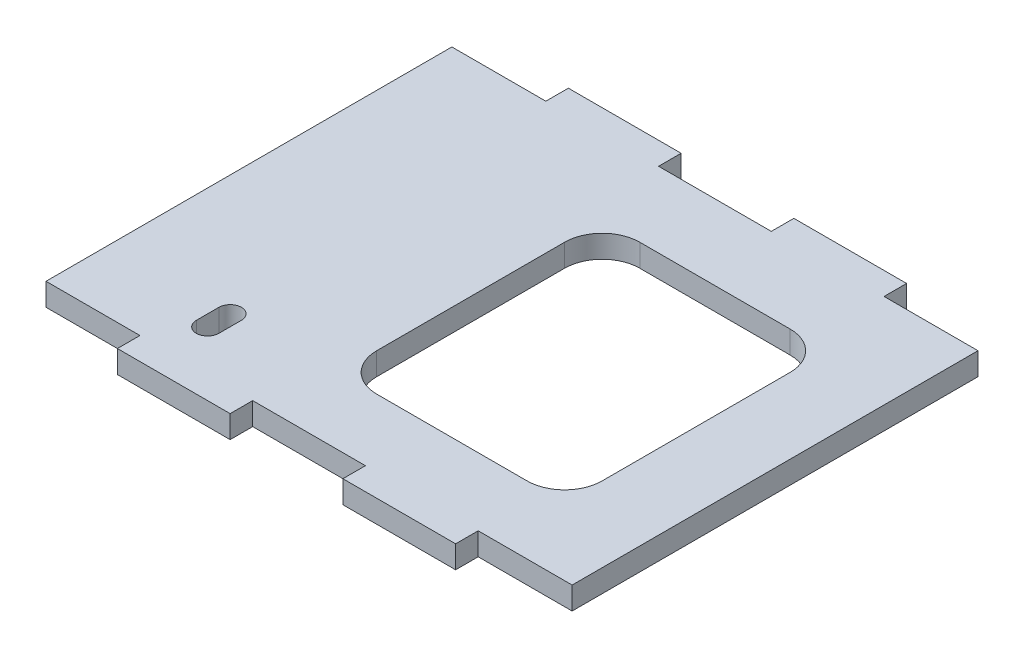
from build123d import *

# Parameters (mm, degrees)
BOSS_EXTRUDE1_DEPTH = 3
CUT_EXTRUDE1_DEPTH  = 47.19523785
CUT_EXTRUDE3_DEPTH  = 47.19523785


with BuildPart() as part:
    # Sketch1 → Boss-Extrude1 (new body)
    with BuildSketch(Plane(origin=(0, 0, 0), x_dir=(1, 0, 0), z_dir=(0, 1, 0))):
        Polygon((-35, 27), (-22.5, 27), (-22.5, 30), (-7.5, 30), (-7.5, 27), (7.5, 27), (7.5, 30), (22.5, 30), (22.5, 27), (35, 27), (35, -27), (22.5, -27), (22.5, -30), (7.5, -30), (7.5, -27), (-7.5, -27), (-7.5, -30), (-22.5, -30), (-22.5, -27), (-35, -27), align=None)
    extrude(amount=BOSS_EXTRUDE1_DEPTH)

    # Sketch2 → Cut-Extrude1 (cut, through all)
    with BuildSketch(Plane(origin=(0, 3, 0), x_dir=(1, 0, 0), z_dir=(0, 1, 0))):
        with BuildLine():
            Line((0, 17), (20, 17))
            ThreePointArc((20, 17), (23.535533906, 15.535533906), (25, 12))
            Line((25, 12), (25, -13))
            ThreePointArc((25, -13), (23.535533906, -16.535533906), (20, -18))
            Line((20, -18), (0, -18))
            ThreePointArc((0, -18), (-3.535533906, -16.535533906), (-5, -13))
            Line((-5, -13), (-5, 12))
            ThreePointArc((-5, 12), (-3.535533906, 15.535533906), (0, 17))
        make_face()
    extrude(amount=-CUT_EXTRUDE1_DEPTH, mode=Mode.SUBTRACT)

    # Sketch4 → Cut-Extrude3 (cut, through all)
    with BuildSketch(Plane(origin=(0, 3, 0), x_dir=(1, 0, 0), z_dir=(0, 1, 0))):
        with BuildLine():
            Line((-17.5, -18.5), (-17.5, -21.5))
            ThreePointArc((-17.5, -21.5), (-19, -23), (-20.5, -21.5))
            Line((-20.5, -21.5), (-20.5, -18.5))
            ThreePointArc((-20.5, -18.5), (-19, -17), (-17.5, -18.5))
        make_face()
    extrude(amount=-CUT_EXTRUDE3_DEPTH, mode=Mode.SUBTRACT)


solid = part.part
